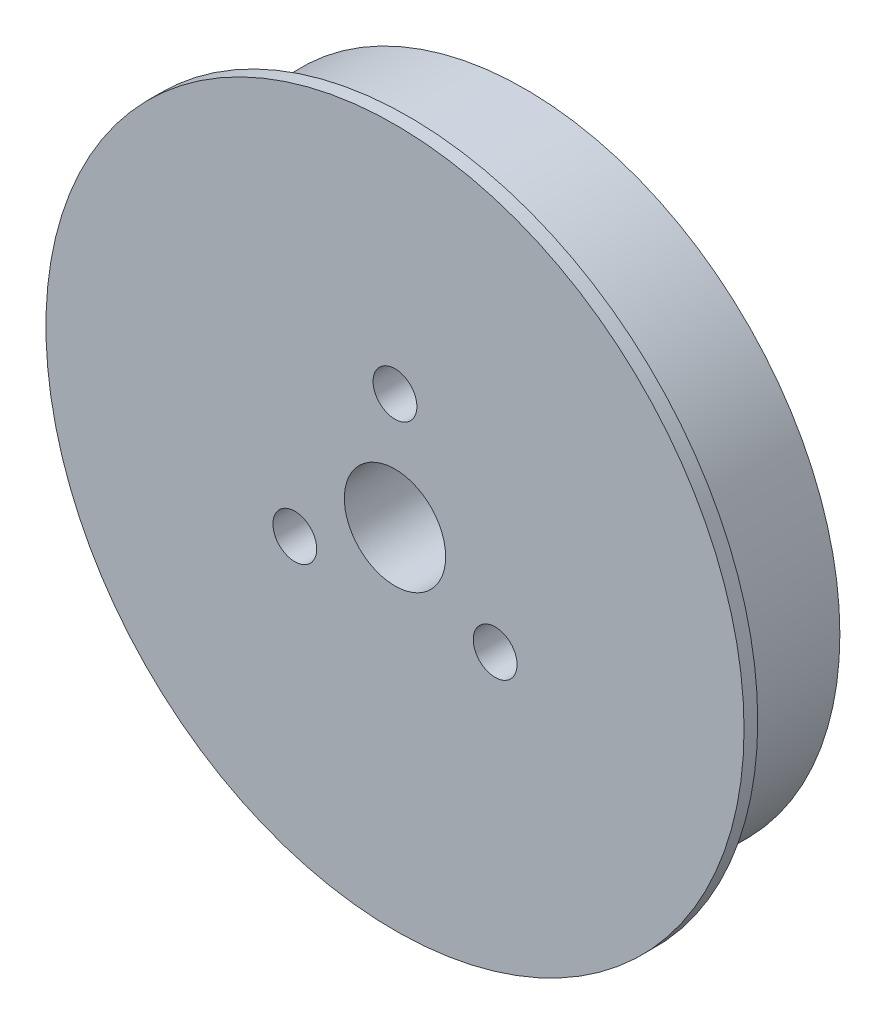
from build123d import *

# Parameters (mm, degrees)
SKETCH1_R           = 23
SKETCH1_R_2         = 3.7
BOSS_EXTRUDE1_DEPTH = 9.5
BOSS_EXTRUDE3_START = -1
SKETCH9_R           = 25.5
SKETCH9_R_2         = 23
BOSS_EXTRUDE3_DEPTH = 1
HOLE1_D             = 3.2


with BuildPart() as part:
    # Sketch1 → Boss-Extrude1 (new body)
    with BuildSketch(Plane.XY):
        Circle(SKETCH1_R)
        Circle(SKETCH1_R_2, mode=Mode.SUBTRACT)
    extrude(amount=BOSS_EXTRUDE1_DEPTH)

    # Sketch9 → Boss-Extrude3 (add)
    with BuildSketch(Plane.XY.offset(9.5).offset(BOSS_EXTRUDE3_START)):
        Circle(SKETCH9_R)
        Circle(SKETCH9_R_2, mode=Mode.SUBTRACT)
    extrude(amount=BOSS_EXTRUDE3_DEPTH)

    # Hole1 (through all)
    with Locations(Plane(origin=(0, 8.45, 0), x_dir=(-1, 0, 0), z_dir=(0, 0, -1))):
        with Locations((0, 0), (-7.317914662, -12.675), (7.317914662, -12.675)):
            Hole(HOLE1_D / 2)


solid = part.part
